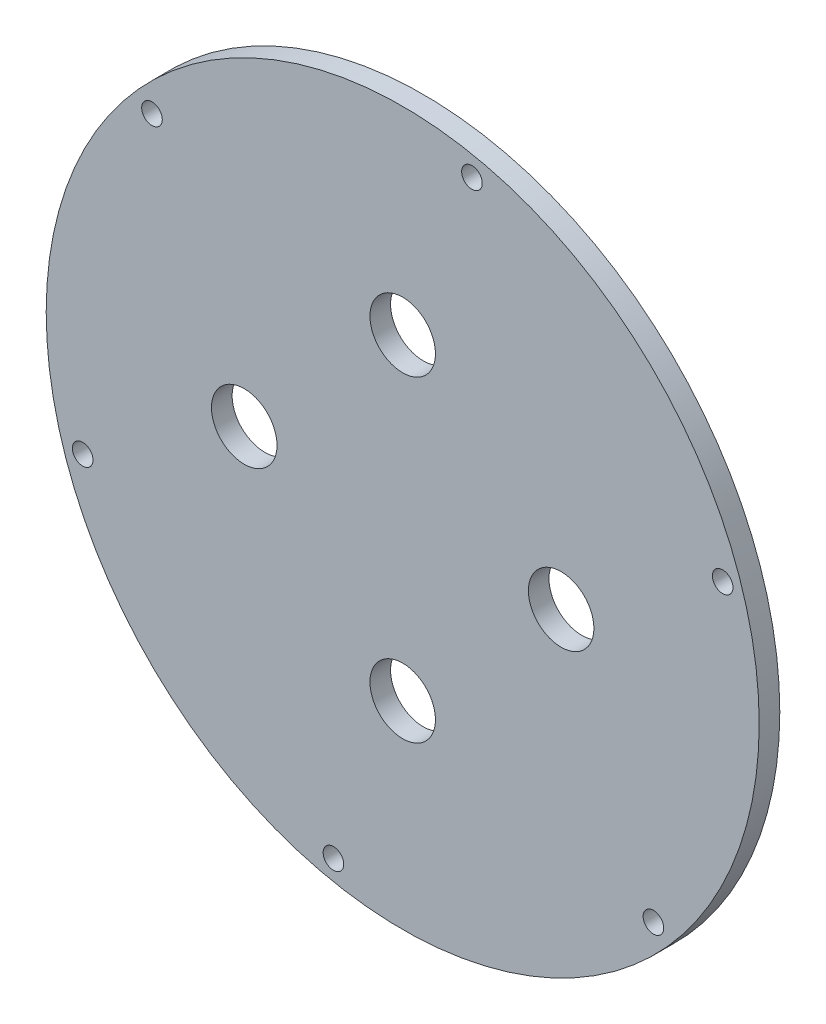
from build123d import *

# Parameters (mm, degrees)
SKETCH_1_R                     = 57.15
EXTRUDE_1_DEPTH                = 3.302
SKETCH_2_R                     = 1.651
CUT_EXTRUDE_1_DEPTH            = 81.889728668
M10_CLEARANCE_HOLE1_AT_2_COUNT = 2
M10_CLEARANCE_HOLE1_AT_2_PITCH = 50.8
CIRPATTERN1_COUNT              = 4


with BuildPart() as part:
    # 草图1 → 凸台-拉伸1 (new body)
    with BuildSketch(Plane.XY):
        with Locations(Location((0, 0, 0), (0, 0, 180))):
            Circle(SKETCH_1_R)
    extrude(amount=EXTRUDE_1_DEPTH)

    # 草图2 → 切除-拉伸1 (cut, through all)
    with BuildSketch(Plane(origin=(0, 0, 0), x_dir=(-1, 0, 0), z_dir=(0, 0, -1))):
        with Locations((-51.295425161, 16.7952369)):
            Circle(SKETCH_2_R)
        with Locations((-11.102610763, 52.820759738)):
            Circle(SKETCH_2_R)
        with Locations((40.192814398, 36.025522838)):
            Circle(SKETCH_2_R)
        with Locations((51.295425161, -16.7952369)):
            Circle(SKETCH_2_R)
        with Locations((11.102610763, -52.820759738)):
            Circle(SKETCH_2_R)
        with Locations((-40.192814398, -36.025522838)):
            Circle(SKETCH_2_R)
    extrude(amount=-CUT_EXTRUDE_1_DEPTH, mode=Mode.SUBTRACT)

    # Sketch3 → M10 Clearance Hole1 (revolve, cut)
    with BuildSketch(Plane.YZ.offset(25.4)):
        Polygon((0, 0), (0, 28.55451825), (5.25, 25.4), (5.25, 0), align=None)
    m10_clearance_hole1 = revolve(axis=Axis((25.4, 0, -6.35), (0, 0, 1)), mode=Mode.SUBTRACT)

    # M10 Clearance Hole1 at 2: M10 Clearance Hole1 ×2
    with Locations(*[(-i * M10_CLEARANCE_HOLE1_AT_2_PITCH, 0, 0) for i in range(1, M10_CLEARANCE_HOLE1_AT_2_COUNT)]):
        add(m10_clearance_hole1, mode=Mode.SUBTRACT)

    # CirPattern1: M10 Clearance Hole1 ×4 about axis
    cirpattern1_axis = Axis((0, 0, 0), (0, 0, 1))
    for i in range(1, CIRPATTERN1_COUNT):
        add(m10_clearance_hole1.rotate(cirpattern1_axis, i * 360 / CIRPATTERN1_COUNT), mode=Mode.SUBTRACT)

    # CirPattern1 copy 1 sketch → CirPattern1 copy 1 (revolve, cut)
    with BuildSketch(Plane(origin=(0, -25.4, 0), x_dir=(-1, 0, 0), z_dir=(0, 1, 0))):
        Polygon((0, 0), (0, 28.55451825), (5.25, 25.4), (5.25, 0), align=None)
    revolve(axis=Axis((0, -25.4, -6.35), (0, 0, 1)), mode=Mode.SUBTRACT)

    # CirPattern1 copy 2 sketch → CirPattern1 copy 2 (revolve, cut)
    with BuildSketch(Plane(origin=(25.4, 0, 0), x_dir=(0, -1, 0), z_dir=(-1, 0, 0))):
        Polygon((0, 0), (0, 28.55451825), (5.25, 25.4), (5.25, 0), align=None)
    revolve(axis=Axis((25.4, 0, -6.35), (0, 0, 1)), mode=Mode.SUBTRACT)

    # CirPattern1 copy 3 sketch → CirPattern1 copy 3 (revolve, cut)
    with BuildSketch(Plane.XZ.offset(-25.4)):
        Polygon((0, 0), (0, 28.55451825), (5.25, 25.4), (5.25, 0), align=None)
    revolve(axis=Axis((0, 25.4, -6.35), (0, 0, 1)), mode=Mode.SUBTRACT)


solid = part.part
